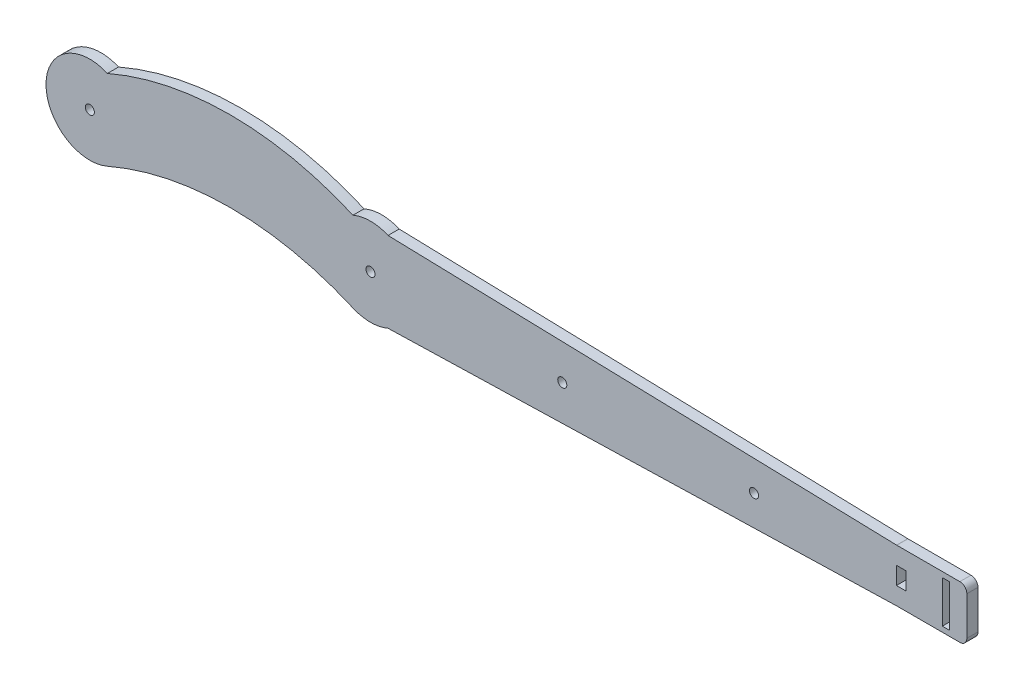
from build123d import *

# Parameters (mm, degrees)
BOSS_EXTRUDE1_DEPTH = 3.175
SKETCH2_R           = 1.2925
SKETCH2_W           = 2
SKETCH2_H           = 12
SKETCH2_W_2         = 2.75
SKETCH2_H_2         = 5
CUT_EXTRUDE1_DEPTH  = 172.061595414
FILLET1_R           = 2


with BuildPart() as part:
    # Sketch1 → Boss-Extrude1 (new body)
    with BuildSketch(Plane.XY):
        with BuildLine():
            Line((150, 7.5), (5, 11.456439237))
            ThreePointArc((5, 11.456439237), (0, 12.5), (-5, 11.456439237))
            ThreePointArc((-5, 11.456439237), (-40, 18.761364576), (-75, 11.456439237))
            ThreePointArc((-75, 11.456439237), (-92.5, 0), (-75, -11.456439237))
            ThreePointArc((-75, -11.456439237), (-40, -4.151513899), (-5, -11.456439237))
            ThreePointArc((-5, -11.456439237), (0, -12.5), (5, -11.456439237))
            Line((5, -11.456439237), (150, -7.5))
            Line((150, -7.5), (170, -7.5))
            Line((170, -7.5), (170, 7.5))
            Line((170, 7.5), (150, 7.5))
        make_face()
    extrude(amount=BOSS_EXTRUDE1_DEPTH)

    # Sketch2 → Cut-Extrude1 (cut, through all)
    with BuildSketch(Plane.XY.offset(3.175)):
        with Locations((-80, 0)):
            Circle(SKETCH2_R)
        with Locations((54.666666667, 0)):
            Circle(SKETCH2_R)
        with Locations((109.333333333, 0)):
            Circle(SKETCH2_R)
        Circle(SKETCH2_R)
        with Locations((164, 0)):
            Rectangle(SKETCH2_W, SKETCH2_H)
        with Locations((151.3, 0)):
            Rectangle(SKETCH2_W_2, SKETCH2_H_2)
    extrude(amount=-CUT_EXTRUDE1_DEPTH, mode=Mode.SUBTRACT)

    # Fillet1
    fillet1_edges = [part.edges().sort_by_distance(p)[0] for p in [
        (170, 7.5, 1.5875),
        (170, -7.5, 1.5875),
        (150, -7.5, 1.5875),
        (150, 7.5, 1.5875),
    ]]
    fillet(fillet1_edges, radius=FILLET1_R)


solid = part.part
